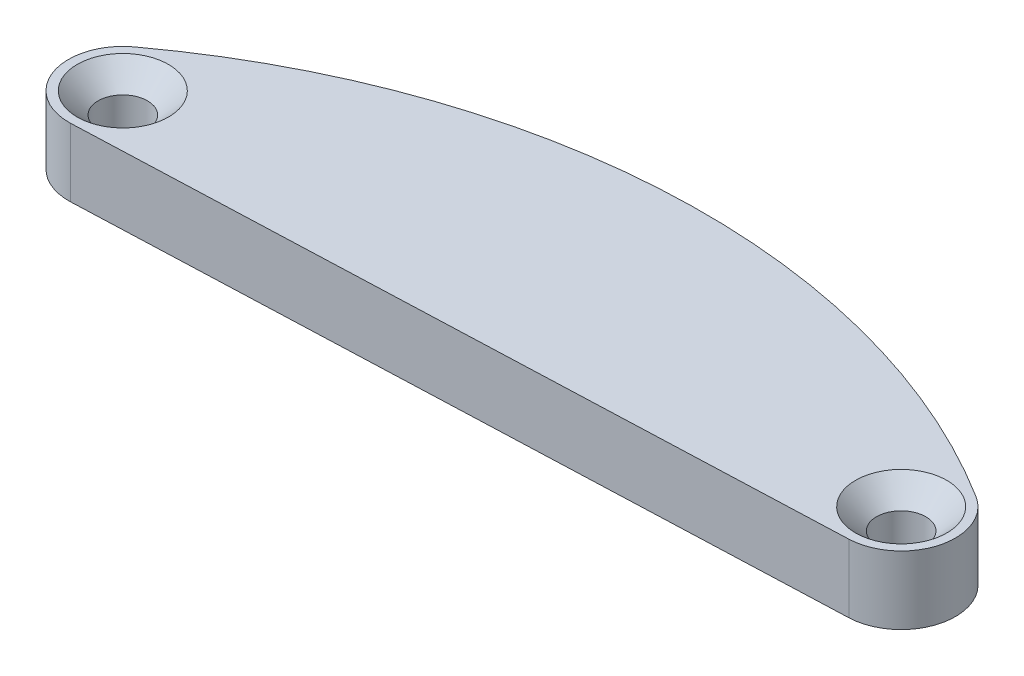
from build123d import *

# Parameters (mm, degrees)
BOSS_EXTRUDE1_DEPTH                             = 4.699
CSK_FOR_M3_FLAT_HEAD_MACHINE_SCREW1_D           = 3.4
CSK_FOR_M3_FLAT_HEAD_MACHINE_SCREW1_CSINK_D     = 6.3
CSK_FOR_M3_FLAT_HEAD_MACHINE_SCREW1_CSINK_ANGLE = 90


with BuildPart() as part:
    # Sketch1 → Boss-Extrude1 (new body)
    with BuildSketch(Plane(origin=(0, 0, 0), x_dir=(1, 0, 0), z_dir=(0, 1, 0))):
        with BuildLine():
            Line((-27.186408409, 33.252800217), (24.537514164, 35.252800217))
            ThreePointArc((24.537514164, 35.252800217), (28.016450893, 38.035446755), (26.381150789, 42.179347826))
            ThreePointArc((26.381150789, 42.179347826), (-1.922238221, 49.712850454), (-29.559395906, 40.016304348))
            ThreePointArc((-29.559395906, 40.016304348), (-30.869828758, 35.758501128), (-27.186408409, 33.252800217))
        make_face()
    extrude(amount=BOSS_EXTRUDE1_DEPTH)

    # CSK for M3 Flat Head Machine Screw1 (through all)
    with Locations(Plane(origin=(0, 4.699, 0), x_dir=(1, 0, 0), z_dir=(0, 1, 0))):
        with Locations((-27.331300737, 37), (24.392621835, 39)):
            CounterSinkHole(CSK_FOR_M3_FLAT_HEAD_MACHINE_SCREW1_D / 2, CSK_FOR_M3_FLAT_HEAD_MACHINE_SCREW1_CSINK_D / 2, counter_sink_angle=CSK_FOR_M3_FLAT_HEAD_MACHINE_SCREW1_CSINK_ANGLE)


solid = part.part
